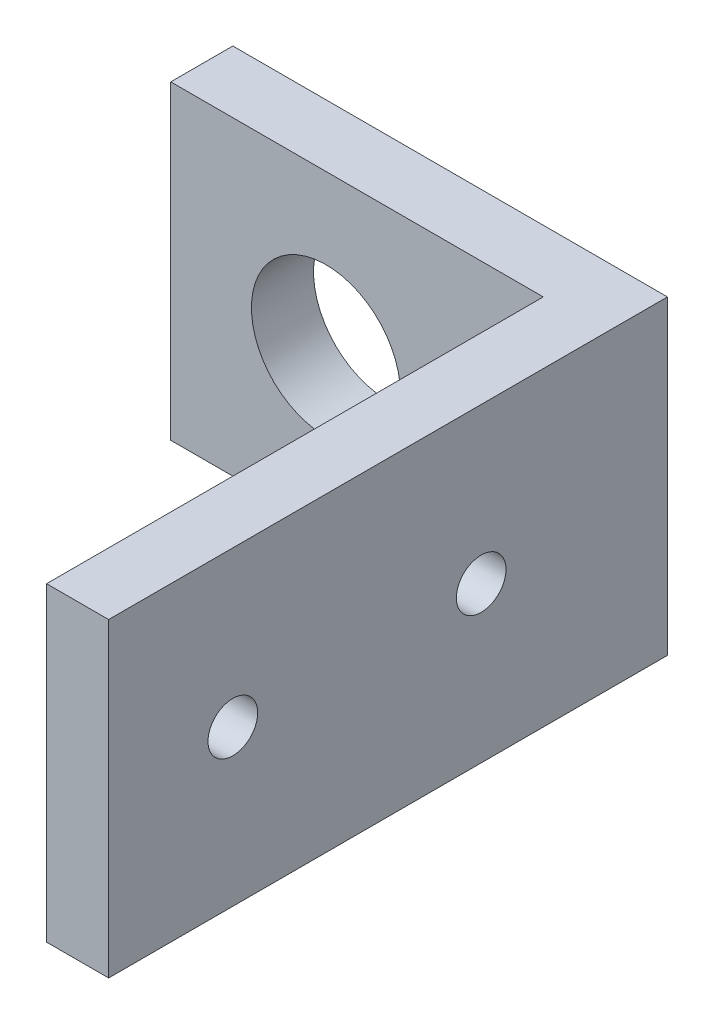
from build123d import *

# Parameters (mm, degrees)
SKETCH1_W           = 35
SKETCH1_H           = 25
BOSS_EXTRUDE1_DEPTH = 5
SKETCH2_W           = 5
SKETCH2_H           = 25
BOSS_EXTRUDE2_DEPTH = 40
SKETCH3_R           = 6
CUT_EXTRUDE1_DEPTH  = 59.736700622
SKETCH4_R           = 2
CUT_EXTRUDE2_DEPTH  = 60.581876439


with BuildPart() as part:
    # Sketch1 → Boss-Extrude1 (new body)
    with BuildSketch(Plane.XY):
        with Locations((17.5, 12.5)):
            Rectangle(SKETCH1_W, SKETCH1_H)
    extrude(amount=BOSS_EXTRUDE1_DEPTH)

    # Sketch2 → Boss-Extrude2 (add)
    with BuildSketch(Plane.XY.offset(5)):
        with Locations((32.5, 12.5)):
            Rectangle(SKETCH2_W, SKETCH2_H)
    extrude(amount=BOSS_EXTRUDE2_DEPTH)

    # Sketch3 → Cut-Extrude1 (cut, through all)
    with BuildSketch(Plane.XY.offset(5)):
        with Locations((12.5, 12.5)):
            Circle(SKETCH3_R)
    extrude(amount=-CUT_EXTRUDE1_DEPTH, mode=Mode.SUBTRACT)

    # Sketch4 → Cut-Extrude2 (cut, through all)
    with BuildSketch(Plane.ZY.offset(-30)):
        with Locations(Location((15, 12.5, 0), (0, 0, 270))):
            Circle(SKETCH4_R)
        with Locations(Location((35, 12.5, 0), (0, 0, 270))):
            Circle(SKETCH4_R)
    extrude(amount=-CUT_EXTRUDE2_DEPTH, mode=Mode.SUBTRACT)


solid = part.part
